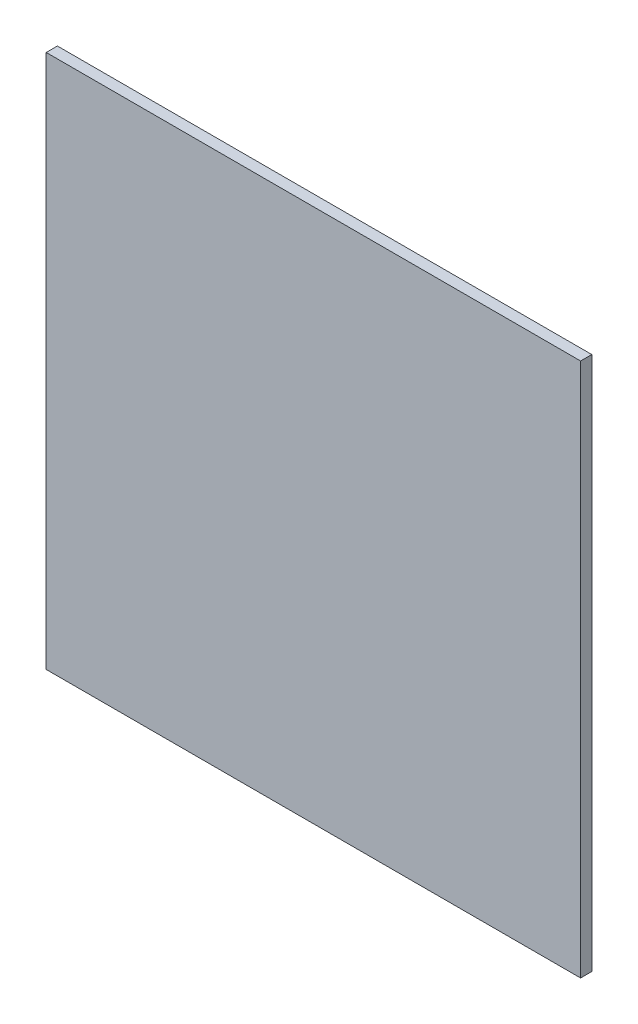
from build123d import *

# Parameters (mm, degrees)
SKETCH1_W           = 303.53
SKETCH1_H           = 303.53
BOSS_EXTRUDE1_DEPTH = 6.35


with BuildPart() as part:
    # Sketch1 → Boss-Extrude1 (new body)
    with BuildSketch(Plane.XY):
        Rectangle(SKETCH1_W, SKETCH1_H)
    extrude(amount=BOSS_EXTRUDE1_DEPTH)


solid = part.part
